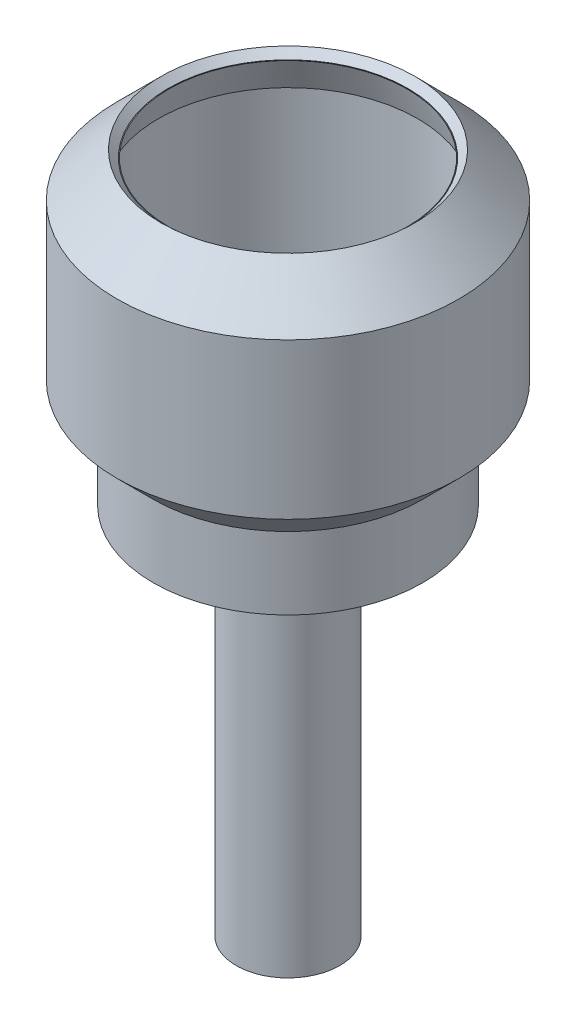
from build123d import *

# Parameters (mm, degrees)
SKETCH2_R           = 2.5
BOSS_EXTRUDE1_DEPTH = 18


with BuildPart() as part:
    # Sketch1 → Revolve1 (revolve)
    with BuildSketch(Plane.XY):
        Polygon((0, 0), (-6.5, 0), (-6.5, 3.48875), (-8.25, 5.23875), (-8.25, 12.73875), (-6.128679656, 14.860070344), (-5.790903941, 14.522294629), (-7.75, 12.56319857), (-7.75, 5.56319857), (-6, 3.81319857), (-6, 0.5), (0, 0.5), align=None)
    revolve(axis=Axis((0, 0.5, 0), (0, -1, 0)))

    # Sketch2 → Boss-Extrude1 (add)
    with BuildSketch(Plane.XZ):
        Circle(SKETCH2_R)
    extrude(amount=BOSS_EXTRUDE1_DEPTH)

    # Sketch3 → Revolve2 (revolve)
    with BuildSketch(Plane.XY):
        Polygon((7.756571399, 12.572177682), (7.756571399, 5.526763194), (6.042904197, 3.762081274), (6.042904197, 0.47971139), (0, 0.47971139), (0, 1.150787733), (4.526358004, 1.150787733), (4.526358004, 4.087737861), (6.256571399, 5.869458543), (6.256571399, 12.21791401), (6.256571399, 13.029033499), (5.755922464, 14.51499039), align=None)
    revolve(axis=Axis((0, 0.47971139, 0), (0, 1, 0)))


solid = part.part
